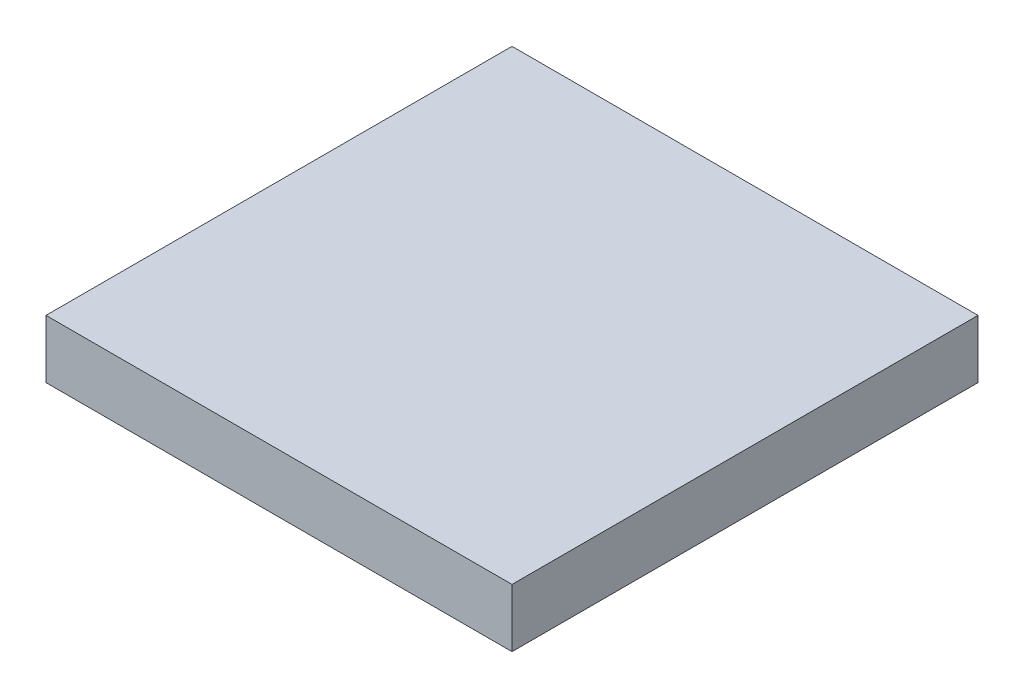
from build123d import *

# Parameters (mm, degrees)
SKETCH1_W           = 120
SKETCH1_H           = 120
BOSS_EXTRUDE1_DEPTH = 7.5


with BuildPart() as part:
    # Sketch1 → Boss-Extrude1 (new, symmetric)
    with BuildSketch(Plane(origin=(0, 0, 0), x_dir=(1, 0, 0), z_dir=(0, 1, 0))):
        Rectangle(SKETCH1_W, SKETCH1_H)
    extrude(amount=BOSS_EXTRUDE1_DEPTH, both=True)


solid = part.part
